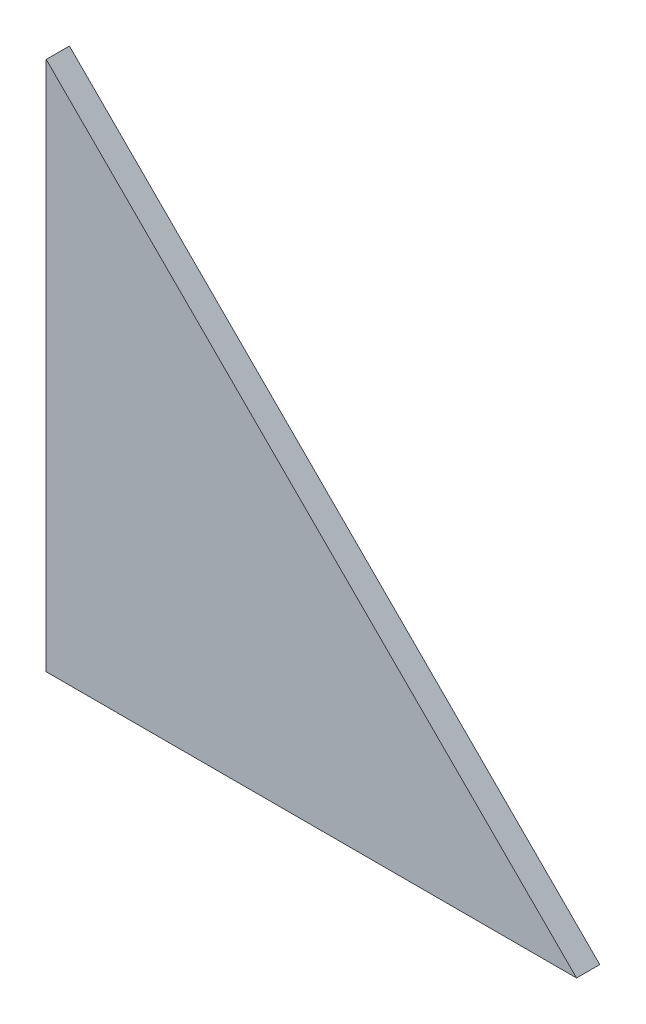
from build123d import *

# Parameters (mm, degrees)
BOSS_EXTRUDE1_DEPTH = 4.445


with BuildPart() as part:
    # Sketch2 → Boss-Extrude1 (new body)
    with BuildSketch(Plane.XY):
        Polygon((0, 0), (101.6, 0), (0, 101.6), align=None)
    extrude(amount=BOSS_EXTRUDE1_DEPTH)


solid = part.part
